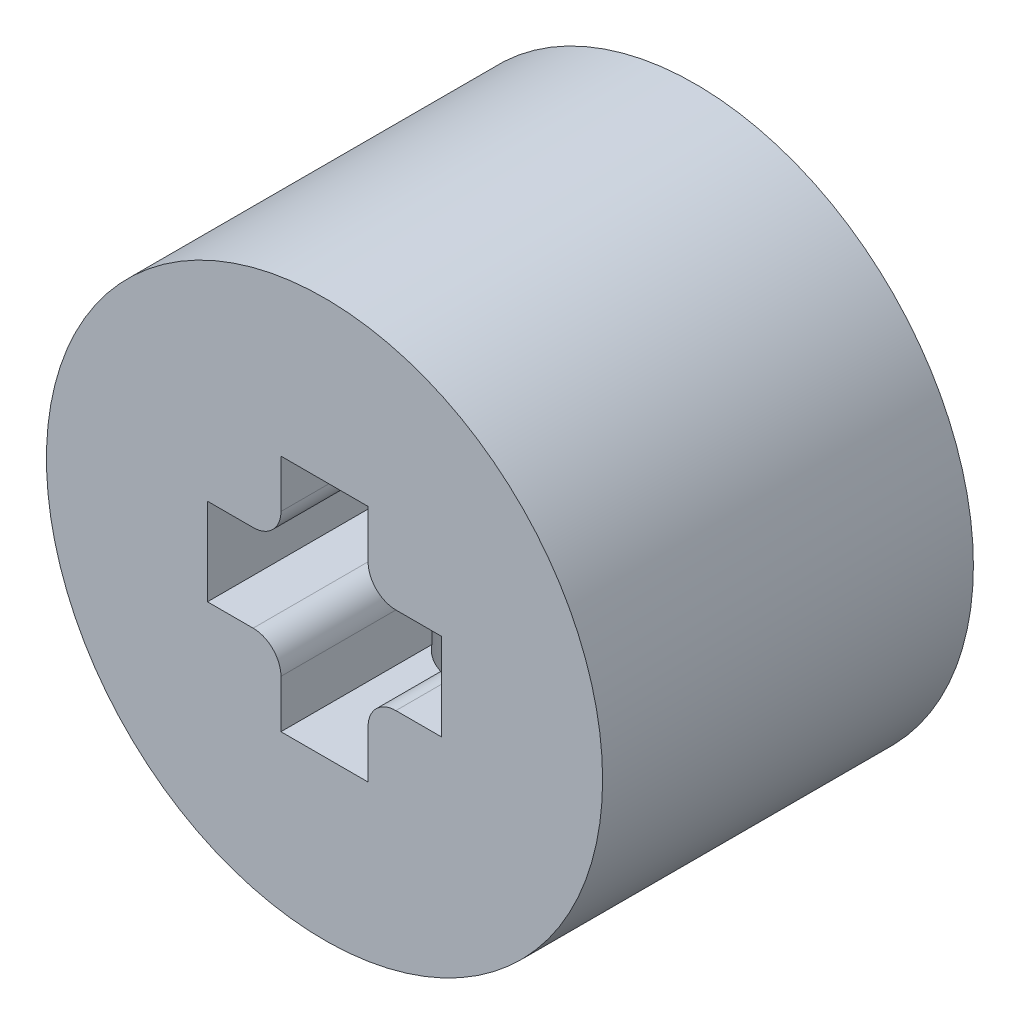
from build123d import *

# Parameters (mm, degrees)
SKETCH_1_R               = 6
EXTRUDE_1_DEPTH          = 8
SKETCH_2_W               = 5.05
SKETCH_2_H               = 1.88
SKETCH_2_W_2             = 1.88
SKETCH_2_H_2             = 5.15
CUT_EXTRUDE_1_DEPTH      = 12.66190379
FILLET_1_R               = 0.6
CUT_EXTRUDE_2_DEPTH      = 0.5
CUT_EXTRUDE_2_DEPTH_BACK = 14.17310233
SKETCH_3_R               = 1.2


with BuildPart() as part:
    # ｽｹｯﾁ1 → ﾎﾞｽ - 押し出し1 (new body)
    with BuildSketch(Plane.XY):
        Circle(SKETCH_1_R)
    extrude(amount=EXTRUDE_1_DEPTH)

    # ｽｹｯﾁ2 → ｶｯﾄ - 押し出し1 (cut, through all)
    with BuildSketch(Plane.XY.offset(8)):
        Rectangle(SKETCH_2_W, SKETCH_2_H)
        Rectangle(SKETCH_2_W_2, SKETCH_2_H_2)
    extrude(amount=-CUT_EXTRUDE_1_DEPTH, mode=Mode.SUBTRACT)

    # ﾌｨﾚｯﾄ1
    fillet_1_edges = [part.edges().sort_by_distance(p)[0] for p in [
        (-0.94, 0.94, 4),
        (0.94, -0.94, 4),
        (-0.94, -0.94, 4),
        (0.94, 0.94, 4),
    ]]
    fillet(fillet_1_edges, radius=FILLET_1_R)

    # ｽｹｯﾁ3 → ｶｯﾄ - 押し出し2 (cut, two sides: drawn at the far end of the back side and taken through both)
    with BuildSketch(Plane(origin=(0, -2.575, 0), x_dir=(1, 0, 0), z_dir=(0, 1, 0)).offset(-CUT_EXTRUDE_2_DEPTH_BACK)):
        with Locations(Location((0, -4, 0), (0, 0, 90))):
            Circle(SKETCH_3_R)
    extrude(amount=CUT_EXTRUDE_2_DEPTH + CUT_EXTRUDE_2_DEPTH_BACK, mode=Mode.SUBTRACT)


solid = part.part
